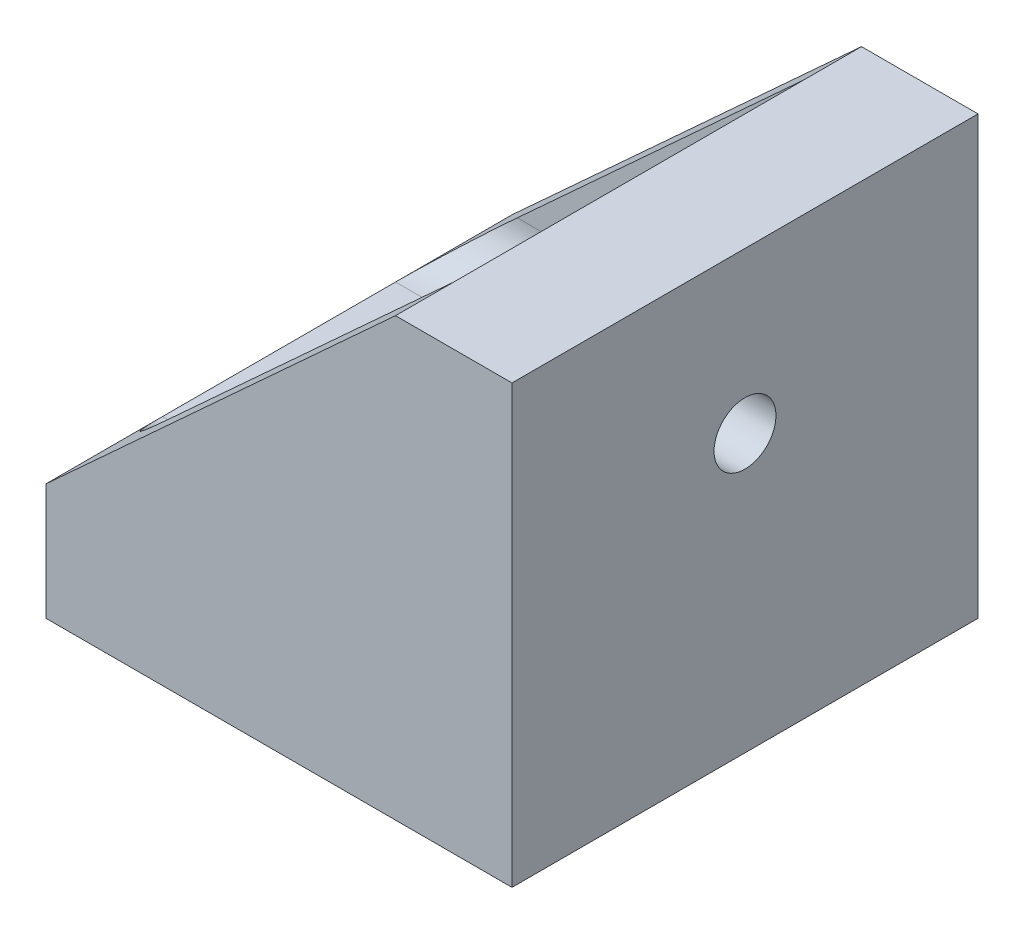
from build123d import *

# Parameters (mm, degrees)
BOSS_EXTRUDE1_DEPTH                      = 50.8
CBORE_FOR_M12_HEX_HEAD_BOLT1_D           = 13.5
CBORE_FOR_M12_HEX_HEAD_BOLT1_CBORE_D     = 23.78
CBORE_FOR_M12_HEX_HEAD_BOLT1_CBORE_DEPTH = 7.95
BOSS_EXTRUDE2_DEPTH                      = 12.7
FILLET1_R                                = 12.7


with BuildPart() as part:
    # Sketch1 → Boss-Extrude1 (new, symmetric)
    with BuildSketch(Plane.XY):
        Polygon((0, 0), (101.6, 0), (101.6, 25.4), (101.6, 95.25), (76.2, 95.25), (76.2, 25.4), (0, 25.4), align=None)
    extrude(amount=BOSS_EXTRUDE1_DEPTH, both=True)

    # CBORE for M12 Hex Head Bolt1 (through all)
    with Locations(Plane.ZY.offset(-76.2)):
        with Locations((0, 60.325)):
            CounterBoreHole(CBORE_FOR_M12_HEX_HEAD_BOLT1_D / 2, CBORE_FOR_M12_HEX_HEAD_BOLT1_CBORE_D / 2, CBORE_FOR_M12_HEX_HEAD_BOLT1_CBORE_DEPTH)

    # Sketch5 → Boss-Extrude2 (add)
    with BuildSketch(Plane(origin=(0, 0, -50.8), x_dir=(-1, 0, 0), z_dir=(0, 0, -1))):
        Polygon((-76.2, 95.25), (0, 25.4), (-76.2, 25.4), align=None)
    boss_extrude2 = extrude(amount=-BOSS_EXTRUDE2_DEPTH)

    # Mirror1: Boss-Extrude2 across plane
    add(boss_extrude2.mirror(Plane.XY))

    # Fillet1
    fillet1_edges = [part.edges().sort_by_distance(p)[0] for p in [
        (38.1, 25.4, -38.1),
        (76.2, 25.4, 0),
        (38.1, 25.4, 38.1),
    ]]
    fillet(fillet1_edges, radius=FILLET1_R)


solid = part.part
